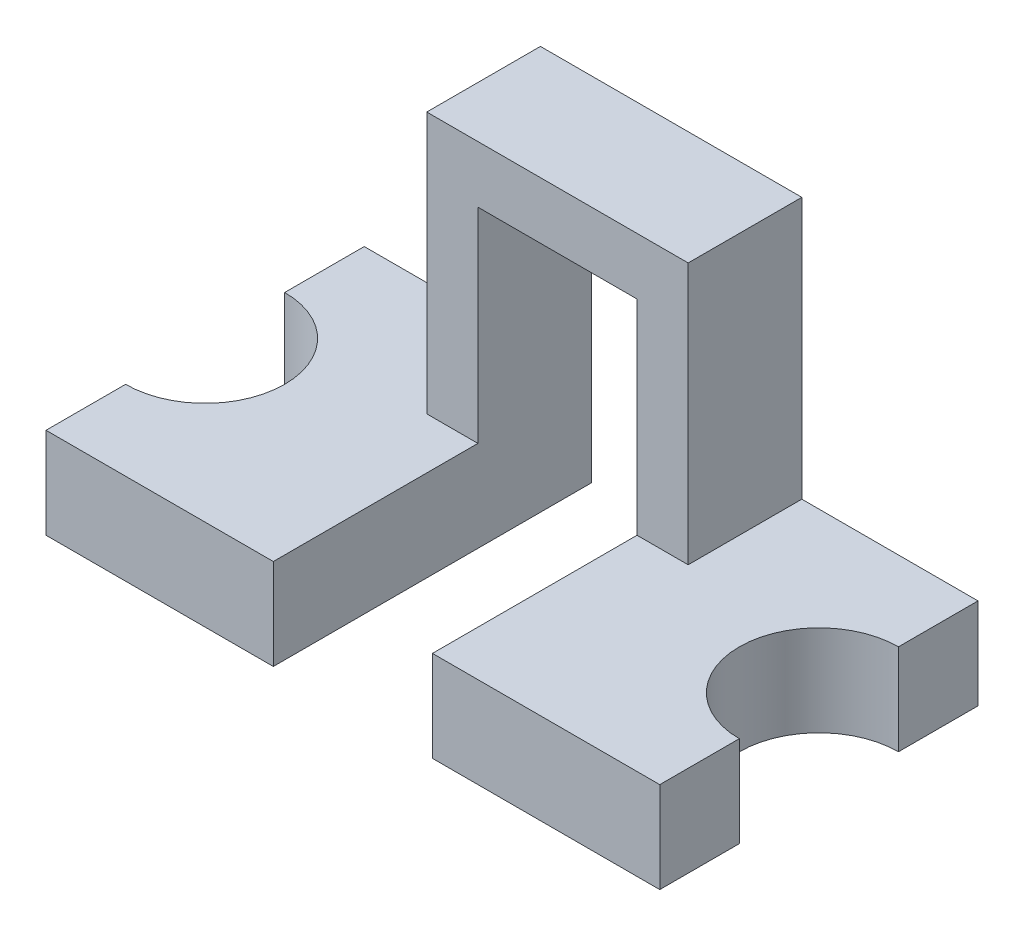
from build123d import *

# Parameters (mm, degrees)
EXTRUDE_1_DEPTH   = 8
EXTRUDE_1_2_DEPTH = 8
EXTRUDE_2_DEPTH   = 10


with BuildPart() as part:
    # 草图1 → 凸台-拉伸1 (new body)
    with BuildSketch(Plane(origin=(0, 0, 0), x_dir=(1, 0, 0), z_dir=(0, 1, 0))):
        with BuildLine():
            Line((27, 21), (27, 28))
            Line((27, 28), (7, 28))
            Line((7, 28), (7, 0))
            Line((7, 0), (27, 0))
            Line((27, 0), (27, 7))
            ThreePointArc((27, 7), (20, 14), (27, 21))
        make_face()
    extrude(amount=EXTRUDE_1_DEPTH)



with BuildPart() as body_2:
    # 草图1 → Extrude 1 2 (new body)
    with BuildSketch(Plane(origin=(0, 0, 0), x_dir=(1, 0, 0), z_dir=(0, 1, 0))):
        with BuildLine():
            Line((-27, 0), (-27, 7))
            ThreePointArc((-27, 7), (-20, 14), (-27, 21))
            Line((-27, 21), (-27, 28))
            Line((-27, 28), (-7, 28))
            Line((-7, 28), (-7, 0))
            Line((-7, 0), (-27, 0))
        make_face()
    extrude(amount=EXTRUDE_1_2_DEPTH)


with BuildPart() as part_1:
    add(part.part)

    add(body_2.part)  # 凸台-拉伸2 merges body 2
    # 草图2 → 凸台-拉伸2 (add)
    with BuildSketch(Plane(origin=(0, 0, -28), x_dir=(-1, 0, 0), z_dir=(0, 0, -1))):
        Polygon((-11.5, 31), (11.5, 31), (11.5, 8), (7, 8), (7, 26), (-7, 26), (-7, 8), (-11.5, 8), align=None)
    extrude(amount=-EXTRUDE_2_DEPTH)


solid = part_1.part
